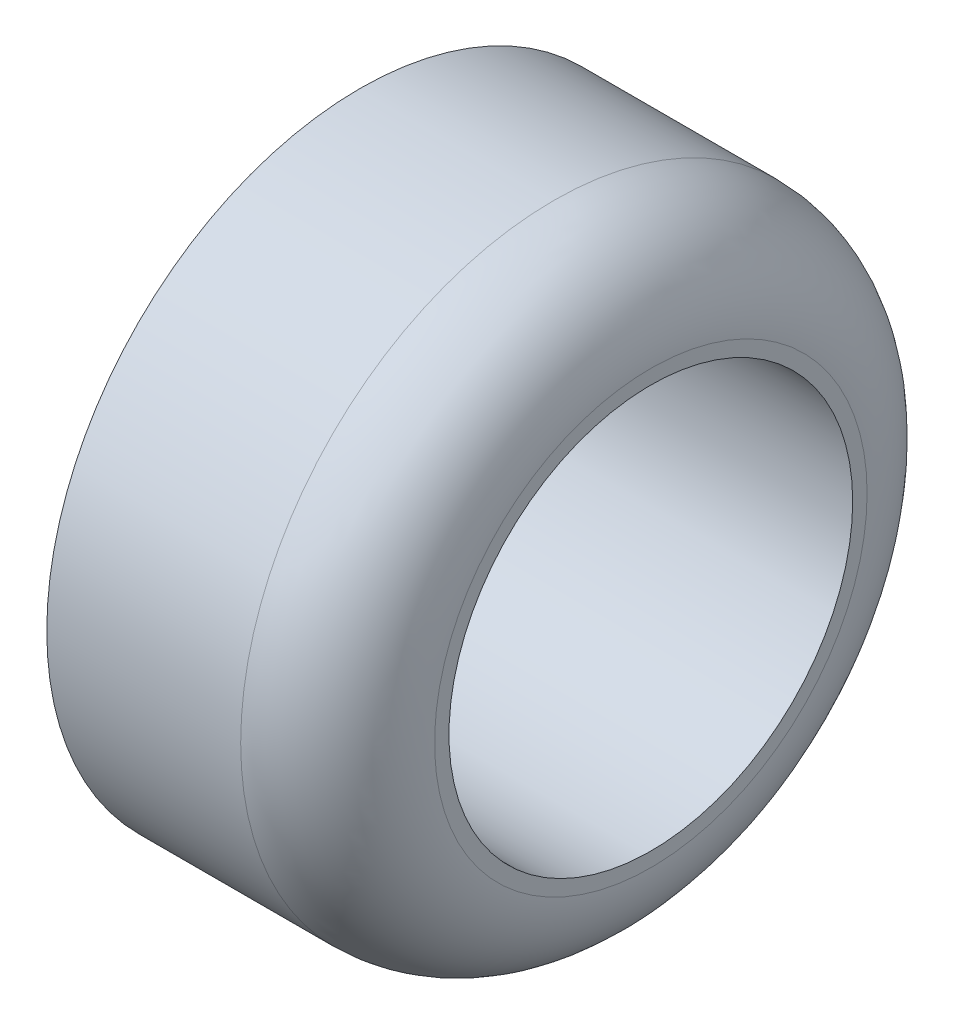
from build123d import *

# Parameters (mm, degrees)
SKETCH2_R           = 4.2672
SKETCH2_R_2         = 2.750058
BOSS_EXTRUDE1_DEPTH = 3.9624
FILLET2_R           = 1.320798984


with BuildPart() as part:
    # Sketch2 → Boss-Extrude1 (new body)
    with BuildSketch(Plane(origin=(0, 0, 0), x_dir=(0, 0, -1), z_dir=(1, 0, 0))):
        Circle(SKETCH2_R)
        Circle(SKETCH2_R_2, mode=Mode.SUBTRACT)
    extrude(amount=-BOSS_EXTRUDE1_DEPTH)

    # Fillet2
    fillet2_edges = [part.edges().sort_by_distance(p)[0] for p in [
        (0, 0, 4.2672),
    ]]
    fillet(fillet2_edges, radius=FILLET2_R)


solid = part.part
